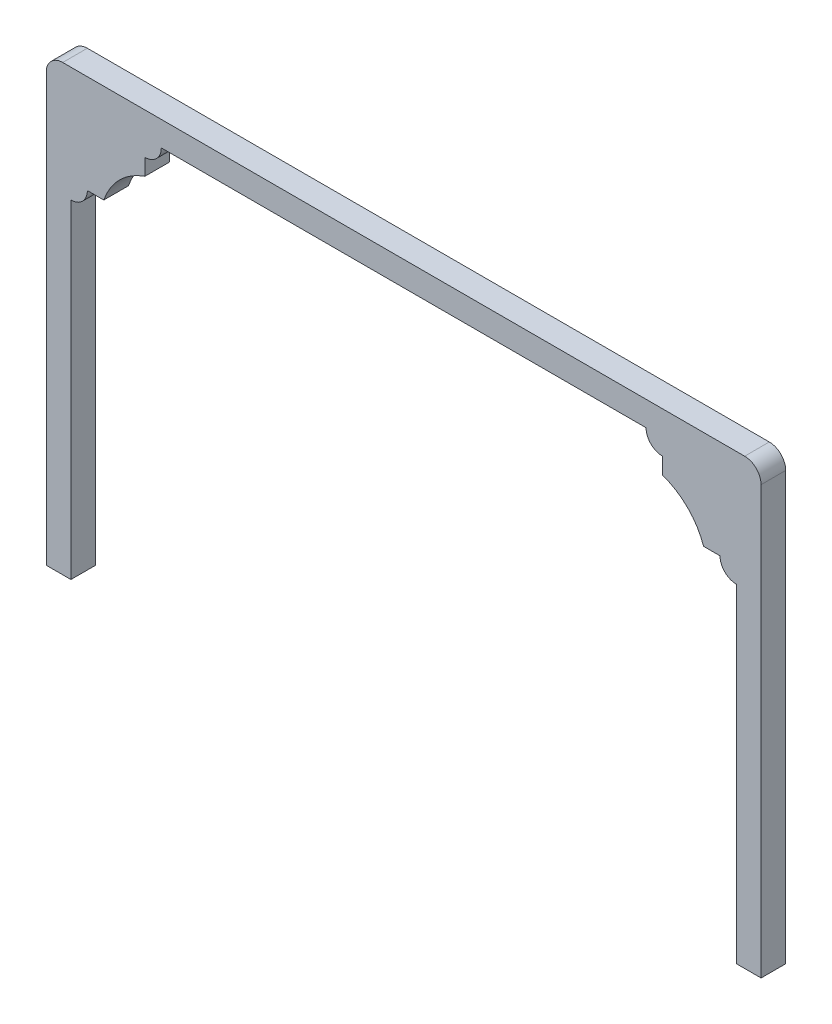
from build123d import *

# Parameters (mm, degrees)
BOSS_EXTRUDE1_DEPTH = 19.05


with BuildPart() as part:
    # Sketch1 → Boss-Extrude1 (new body)
    with BuildSketch(Plane.XY):
        with BuildLine():
            Line((276.225, 0), (257.175, 0))
            Line((257.175, 0), (257.175, 76.2))
            Line((257.175, 76.2), (257.175, 165.1))
            Line((257.175, 165.1), (257.175, 254))
            ThreePointArc((257.175, 254), (248.194743879, 257.719743879), (244.475, 266.7))
            Line((244.475, 266.7), (231.775, 266.7))
            ThreePointArc((231.775, 266.7), (219.598293765, 286.273293765), (200.025, 298.45))
            Line((200.025, 298.45), (200.025, 311.15))
            ThreePointArc((200.025, 311.15), (191.044743879, 314.869743879), (187.325, 323.85))
            Line((187.325, 323.85), (-187.325, 323.85))
            ThreePointArc((-187.325, 323.85), (-191.044743879, 314.869743879), (-200.025, 311.15))
            Line((-200.025, 311.15), (-200.025, 298.45))
            ThreePointArc((-200.025, 298.45), (-219.598293765, 286.273293765), (-231.775, 266.7))
            Line((-231.775, 266.7), (-244.475, 266.7))
            ThreePointArc((-244.475, 266.7), (-248.194743879, 257.719743879), (-257.175, 254))
            Line((-257.175, 254), (-257.175, 165.1))
            Line((-257.175, 165.1), (-257.175, 76.2))
            Line((-257.175, 76.2), (-257.175, 0))
            Line((-257.175, 0), (-276.225, 0))
            Line((-276.225, 0), (-276.225, 330.2))
            ThreePointArc((-276.225, 330.2), (-272.505256121, 339.180256121), (-263.525, 342.9))
            Line((-263.525, 342.9), (263.525, 342.9))
            ThreePointArc((263.525, 342.9), (272.505256121, 339.180256121), (276.225, 330.2))
            Line((276.225, 330.2), (276.225, 0))
        make_face()
    extrude(amount=BOSS_EXTRUDE1_DEPTH)


solid = part.part
